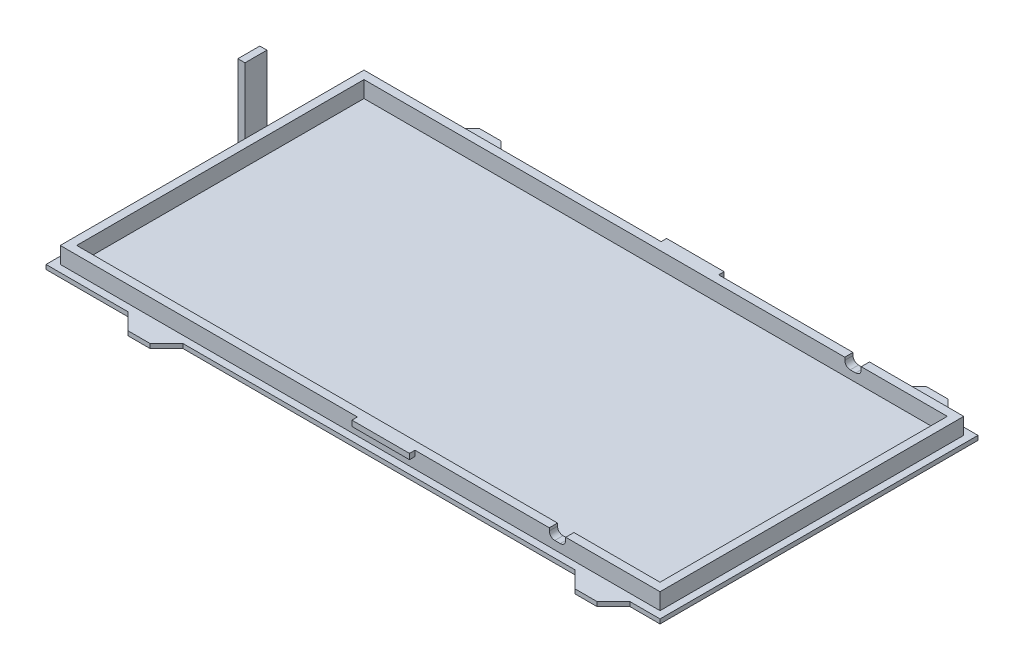
from build123d import *

# Parameters (mm, degrees)
SKETCH1_W               = 112
SKETCH1_H               = 58
BOSS_EXTRUDE1_DEPTH     = 0.8
SKETCH2_W               = 112
SKETCH2_H               = 58
SKETCH2_W_2             = 110
SKETCH2_H_2             = 56
BOSS_EXTRUDE2_DEPTH     = 28
SKETCH3_R               = 1.75
CUT_EXTRUDE1_DEPTH      = 28
BOSS_EXTRUDE3_START     = 2
SKETCH4_R               = 3.25
SKETCH4_R_2             = 1.75
BOSS_EXTRUDE3_DEPTH     = 2
CUT_EXTRUDE2_DEPTH      = 2
CUT_EXTRUDE3_DEPTH      = 72
BOSS_EXTRUDE4_DEPTH     = 28.8
SKETCH8_W               = 11.5
SKETCH8_H               = 1.5
CUT_EXTRUDE4_DEPTH      = 70
CUT_EXTRUDE5_DEPTH      = 70
CUT_EXTRUDE5_DEPTH_BACK = 70
SKETCH9_W               = 112
SKETCH9_H               = 28
SKETCH10_W              = 8.327989843
SKETCH10_H              = 7.445097605
SKETCH10_W_2            = 5.355096577
SKETCH10_H_2            = 5.953712533
SKETCH10_W_3            = 11.410895322
SKETCH10_H_3            = 5.715079946
SKETCH10_W_4            = 8.730278995
SKETCH10_H_4            = 7.857983818
BOSS_EXTRUDE5_DEPTH     = 0.8
SKETCH11_W              = 106.4
SKETCH11_H              = 52.4
BOSS_EXTRUDE6_DEPTH     = 3
SKETCH12_W              = 10.5
SKETCH12_H              = 1
BOSS_EXTRUDE7_DEPTH     = 1
SKETCH13_W              = 10.5
SKETCH13_H              = 1
BOSS_EXTRUDE8_DEPTH     = 1
SKETCH14_W              = 1.3
SKETCH14_H              = 4
BOSS_EXTRUDE9_DEPTH     = 15
SKETCH15_W              = 3
SKETCH15_H              = 1.5
CUT_EXTRUDE6_DEPTH      = 70
FILLET1_R               = 1


with BuildPart() as part:
    # Sketch1 → Boss-Extrude1 (new body)
    with BuildSketch(Plane(origin=(0, 0, 0), x_dir=(1, 0, 0), z_dir=(0, 1, 0))):
        Rectangle(SKETCH1_W, SKETCH1_H)
    extrude(amount=BOSS_EXTRUDE1_DEPTH)

    # Sketch2 → Boss-Extrude2 (add)
    with BuildSketch(Plane(origin=(0, 0.8, 0), x_dir=(1, 0, 0), z_dir=(0, 1, 0))):
        Rectangle(SKETCH2_W, SKETCH2_H)
        Rectangle(SKETCH2_W_2, SKETCH2_H_2, mode=Mode.SUBTRACT)
    extrude(amount=BOSS_EXTRUDE2_DEPTH)

    # Sketch3 → Cut-Extrude1 (cut)
    with BuildSketch(Plane(origin=(0, 0.8, 0), x_dir=(1, 0, 0), z_dir=(0, 1, 0))):
        with Locations(Location((-36, 25.5, 0), (0, 0, 270))):
            Circle(SKETCH3_R)
        with Locations(Location((-36, -25.5, 0), (0, 0, 270))):
            Circle(SKETCH3_R)
        with Locations(Location((45.5, 25.5, 0), (0, 0, 270))):
            Circle(SKETCH3_R)
        with Locations(Location((45.5, -25.5, 0), (0, 0, 270))):
            Circle(SKETCH3_R)
    extrude(amount=-CUT_EXTRUDE1_DEPTH, mode=Mode.SUBTRACT)

    # Sketch4 → Boss-Extrude3 (add)
    # profile 1 of 4: a face of its own
    with BuildSketch(Plane(origin=(0, 0.8, 0), x_dir=(1, 0, 0), z_dir=(0, 1, 0)).offset(BOSS_EXTRUDE3_START)):
        with Locations((-36, 25.5)):
            Circle(SKETCH4_R)
        with Locations(Location((-36, 25.5, 0), (0, 0, 270))):
            Circle(SKETCH4_R_2, mode=Mode.SUBTRACT)
    # profile 2 of 4: a face of its own
    with BuildSketch(Plane(origin=(0, 0.8, 0), x_dir=(1, 0, 0), z_dir=(0, 1, 0)).offset(BOSS_EXTRUDE3_START)):
        with Locations((45.5, 25.5)):
            Circle(SKETCH4_R)
        with Locations(Location((45.5, 25.5, 0), (0, 0, 270))):
            Circle(SKETCH4_R_2, mode=Mode.SUBTRACT)
    # profile 3 of 4: a face of its own
    with BuildSketch(Plane(origin=(0, 0.8, 0), x_dir=(1, 0, 0), z_dir=(0, 1, 0)).offset(BOSS_EXTRUDE3_START)):
        with Locations((-36, -25.5)):
            Circle(SKETCH4_R)
        with Locations(Location((-36, -25.5, 0), (0, 0, 270))):
            Circle(SKETCH4_R_2, mode=Mode.SUBTRACT)
    # profile 4 of 4: a face of its own
    with BuildSketch(Plane(origin=(0, 0.8, 0), x_dir=(1, 0, 0), z_dir=(0, 1, 0)).offset(BOSS_EXTRUDE3_START)):
        with Locations((45.5, -25.5)):
            Circle(SKETCH4_R)
        with Locations(Location((45.5, -25.5, 0), (0, 0, 270))):
            Circle(SKETCH4_R_2, mode=Mode.SUBTRACT)
    extrude(amount=-BOSS_EXTRUDE3_DEPTH)

    # Sketch5 → Cut-Extrude2 (cut)
    with BuildSketch(Plane(origin=(-55, 0, 0), x_dir=(0, 0, -1), z_dir=(1, 0, 0))):
        with BuildLine():
            Line((-10.5, 28.8), (-10.5, 10.8))
            ThreePointArc((-10.5, 10.8), (-8, 8.3), (-5.5, 10.8))
            Line((-5.5, 10.8), (-5.5, 28.8))
            Line((-5.5, 28.8), (-10.5, 28.8))
        make_face()
    extrude(amount=-CUT_EXTRUDE2_DEPTH, mode=Mode.SUBTRACT)

    # Sketch6 → Cut-Extrude3 (cut)
    with BuildSketch(Plane.XY.offset(29)):
        with BuildLine():
            Line((34.5, 25.8), (34.5, 28.8))
            Line((34.5, 28.8), (37.5, 28.8))
            Line((37.5, 28.8), (37.5, 25.8))
            ThreePointArc((37.5, 25.8), (36, 24.3), (34.5, 25.8))
        make_face()
    extrude(amount=-CUT_EXTRUDE3_DEPTH, mode=Mode.SUBTRACT)

    # Sketch7 → Boss-Extrude4 (add)
    with BuildSketch(Plane.XZ):
        Polygon((-41, 29), (-38, 32), (-34, 32), (-31, 29), align=None)
        Polygon((40.5, 29), (43.5, 32), (47.5, 32), (50.5, 29), align=None)
        Polygon((-41, -29), (-38, -32), (-34, -32), (-31, -29), align=None)
        Polygon((40.5, -29), (43.5, -32), (47.5, -32), (50.5, -29), align=None)
    extrude(amount=-BOSS_EXTRUDE4_DEPTH)

    # Sketch8 → Cut-Extrude4 (cut)
    with BuildSketch(Plane.XY.offset(29)):
        with Locations((4.75, 26.55)):
            Rectangle(SKETCH8_W, SKETCH8_H)
    extrude(amount=-CUT_EXTRUDE4_DEPTH, mode=Mode.SUBTRACT)

    # Sketch9 → Cut-Extrude5 (cut, two sides: drawn at the far end of the back side and taken through both)
    with BuildSketch(Plane.XY.offset(29).offset(-CUT_EXTRUDE5_DEPTH_BACK)):
        with Locations((0, 14.8)):
            Rectangle(SKETCH9_W, SKETCH9_H)
    extrude(amount=CUT_EXTRUDE5_DEPTH + CUT_EXTRUDE5_DEPTH_BACK, mode=Mode.SUBTRACT)

    # Sketch10 → Boss-Extrude5 (add)
    with BuildSketch(Plane(origin=(0, 0.8, 0), x_dir=(1, 0, 0), z_dir=(0, 1, 0))):
        with Locations((-35.349106924, 23.952885498)):
            Rectangle(SKETCH10_W, SKETCH10_H)
        with Locations((45.232488371, 24.698578034)):
            Rectangle(SKETCH10_W_2, SKETCH10_H_2)
        with Locations((-36.890559663, -24.651256065)):
            Rectangle(SKETCH10_W_3, SKETCH10_H_3)
        with Locations((45.075573152, -24.28226276)):
            Rectangle(SKETCH10_W_4, SKETCH10_H_4)
    extrude(amount=-BOSS_EXTRUDE5_DEPTH)

    # Sketch11 → Boss-Extrude6 (add)
    with BuildSketch(Plane(origin=(0, 0.8, 0), x_dir=(1, 0, 0), z_dir=(0, 1, 0))):
        Polygon((-51.704605873, 27.7), (-54.7, 27.7), (-54.7, 25.360609515), (-54.7, -24.546387496), (-54.7, -27.7), (-52.806207703, -27.7), (50.795370915, -27.7), (54.7, -27.7), (54.7, -25.222572544), (54.7, 24.684424467), (54.7, 27.7), (51.896972744, 27.7), align=None)
        Rectangle(SKETCH11_W, SKETCH11_H, mode=Mode.SUBTRACT)
    extrude(amount=BOSS_EXTRUDE6_DEPTH)

    # Sketch12 → Boss-Extrude7 (add)
    with BuildSketch(Plane.XY.offset(27.7)):
        with Locations((4.75, 3.3)):
            Rectangle(SKETCH12_W, SKETCH12_H)
    extrude(amount=BOSS_EXTRUDE7_DEPTH)

    # Sketch13 → Boss-Extrude8 (add)
    with BuildSketch(Plane(origin=(0, 0, -27.7), x_dir=(-1, 0, 0), z_dir=(0, 0, -1))):
        with Locations((-4.75, 3.3)):
            Rectangle(SKETCH13_W, SKETCH13_H)
    extrude(amount=BOSS_EXTRUDE8_DEPTH)

    # Sketch14 → Boss-Extrude9 (add)
    with BuildSketch(Plane(origin=(0, 0.8, 0), x_dir=(1, 0, 0), z_dir=(0, 1, 0))):
        with Locations((-55.35, 8)):
            Rectangle(SKETCH14_W, SKETCH14_H)
    extrude(amount=BOSS_EXTRUDE9_DEPTH)

    # Sketch15 → Cut-Extrude6 (cut)
    with BuildSketch(Plane.XY.offset(27.7)):
        with Locations((36, 3.05)):
            Rectangle(SKETCH15_W, SKETCH15_H)
    extrude(amount=-CUT_EXTRUDE6_DEPTH, mode=Mode.SUBTRACT)

    # Fillet1
    fillet1_edges = [part.edges().sort_by_distance(p)[0] for p in [
        (37.5, 2.3, 26.95),
        (37.5, 2.3, -26.95),
        (34.5, 2.3, 26.95),
        (34.5, 2.3, -26.95),
    ]]
    fillet(fillet1_edges, radius=FILLET1_R)


solid = part.part
